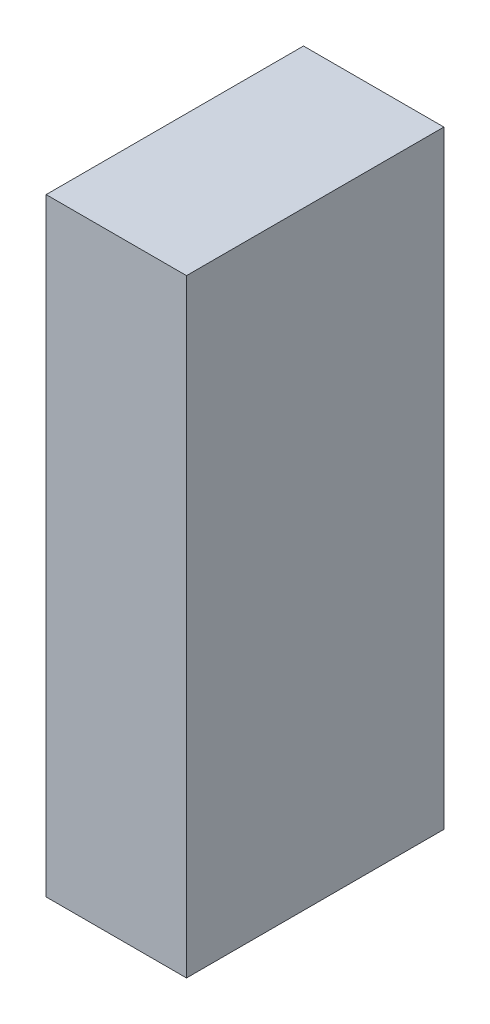
from build123d import *

# Parameters (mm, degrees)
SKETCH1_W           = 600
SKETCH1_H           = 2600
BOSS_EXTRUDE1_DEPTH = 1100
SKETCH2_W           = 100
SKETCH2_H           = 100
CUT_EXTRUDE1_DEPTH  = 100


with BuildPart() as part:
    # Sketch1 → Boss-Extrude1 (new body)
    with BuildSketch(Plane.XY):
        Rectangle(SKETCH1_W, SKETCH1_H)
    extrude(amount=BOSS_EXTRUDE1_DEPTH)

    # Sketch2 → Cut-Extrude1 (cut)
    with BuildSketch(Plane(origin=(0, 0, 0), x_dir=(-1, 0, 0), z_dir=(0, 0, -1))):
        with Locations((0, -750)):
            Rectangle(SKETCH2_W, SKETCH2_H)
    extrude(amount=-CUT_EXTRUDE1_DEPTH, mode=Mode.SUBTRACT)


solid = part.part
